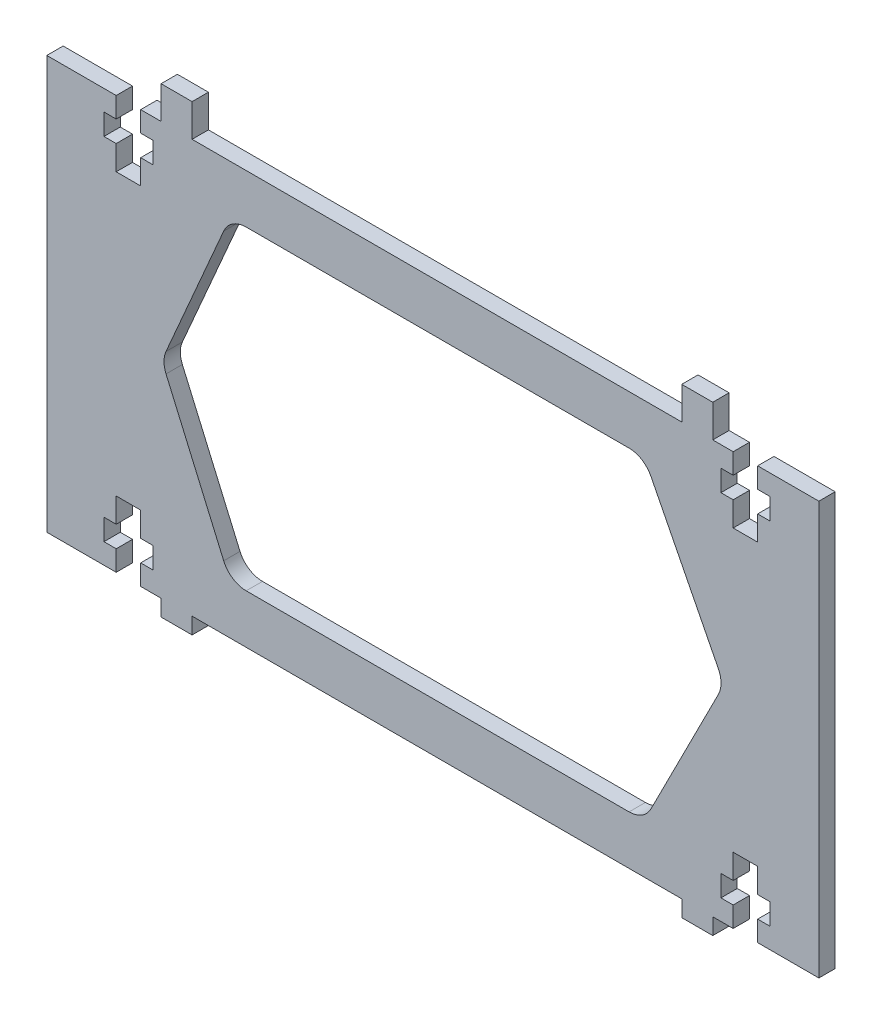
from build123d import *

# Parameters (mm, degrees)
EXTRUDE_1_DEPTH = 2


with BuildPart() as part:
    # 草图1 → 凸台-拉伸1 (new body)
    with BuildSketch(Plane.XY):
        Polygon((-63.278571429, -35.454285714), (-63.278571429, -33.454285714), (-65.778571429, -33.454285714), (-65.778571429, -30.954285714), (-64.278571429, -30.954285714), (-64.278571429, -28.354285714), (-65.778571429, -28.354285714), (-65.778571429, -25.354285714), (-68.778571429, -25.354285714), (-68.778571429, -28.354285714), (-70.278571429, -28.354285714), (-70.278571429, -30.954285714), (-68.778571429, -30.954285714), (-68.778571429, -33.454285714), (-77.278571429, -33.454285714), (-77.278571429, 17.145714286), (-68.778571429, 17.145714286), (-68.778571429, 14.645714286), (-70.278571429, 14.645714286), (-70.278571429, 12.045714286), (-68.778571429, 12.045714286), (-68.778571429, 9.045714286), (-65.778571429, 9.045714286), (-65.778571429, 12.045714286), (-64.278571429, 12.045714286), (-64.278571429, 14.645714286), (-65.778571429, 14.645714286), (-65.778571429, 17.145714286), (-63.278571429, 17.145714286), (-63.278571429, 21.145714286), (-59.478571429, 21.145714286), (-59.478571429, 17.145714286), (0.521428571, 17.145714286), (0.521428571, 21.145714286), (4.321428571, 21.145714286), (4.321428571, 17.145714286), (6.821428571, 17.145714286), (6.821428571, 14.645714286), (5.321428571, 14.645714286), (5.321428571, 12.045714286), (6.821428571, 12.045714286), (6.821428571, 9.045714286), (9.821428571, 9.045714286), (9.821428571, 12.045714286), (11.321428571, 12.045714286), (11.321428571, 14.645714286), (9.821428571, 14.645714286), (9.821428571, 17.145714286), (17.321428571, 17.145714286), (17.321428571, -33.454285714), (9.821428571, -33.454285714), (9.821428571, -30.954285714), (11.321428571, -30.954285714), (11.321428571, -28.354285714), (9.821428571, -28.354285714), (9.821428571, -25.354285714), (6.821428571, -25.354285714), (6.821428571, -28.354285714), (5.321428571, -28.354285714), (5.321428571, -30.954285714), (6.821428571, -30.954285714), (6.821428571, -33.454285714), (4.321428571, -33.454285714), (4.321428571, -35.454285714), (0.521428571, -35.454285714), (0.521428571, -33.454285714), (-59.478571429, -33.454285714), (-59.478571429, -35.454285714), align=None)
        with BuildLine():
            Line((-5.934446775, 11.145714286), (-52.852891654, 11.145714286))
            ThreePointArc((-52.852891654, 11.145714286), (-54.499158877, 10.653662497), (-55.605393612, 9.338917105))
            Line((-55.605393612, 9.338917105), (-62.671403465, -6.961082895))
            ThreePointArc((-62.671403465, -6.961082895), (-62.918901506, -8.154285714), (-62.671403465, -9.347488534))
            Line((-62.671403465, -9.347488534), (-55.605393612, -25.647488534))
            ThreePointArc((-55.605393612, -25.647488534), (-54.499158877, -26.962233925), (-52.852891654, -27.454285714))
            Line((-52.852891654, -27.454285714), (-5.934446775, -27.454285714))
            ThreePointArc((-5.934446775, -27.454285714), (-4.364780678, -27.010874915), (-3.259119179, -25.811717943))
            Line((-3.259119179, -25.811717943), (5.011324171, -9.511717943))
            ThreePointArc((5.011324171, -9.511717943), (5.335996575, -8.154285714), (5.011324171, -6.796853486))
            Line((5.011324171, -6.796853486), (-3.259119179, 9.503146514))
            ThreePointArc((-3.259119179, 9.503146514), (-4.364780678, 10.702303487), (-5.934446775, 11.145714286))
        make_face(mode=Mode.SUBTRACT)
    extrude(amount=EXTRUDE_1_DEPTH)


solid = part.part
